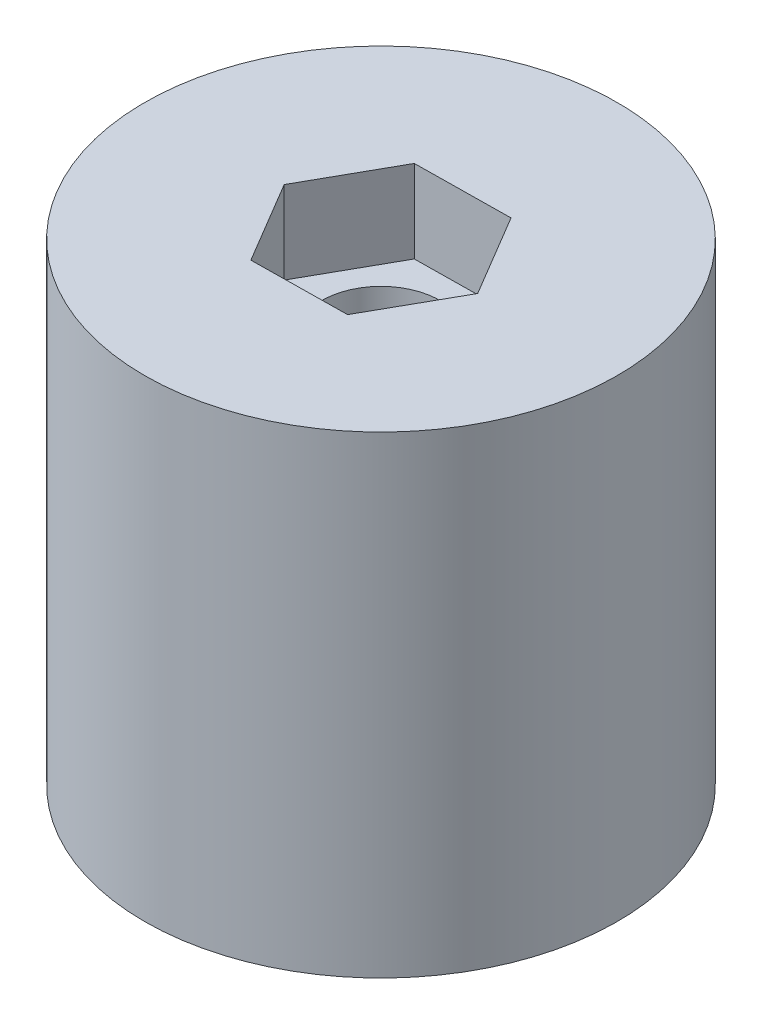
from build123d import *

# Parameters (mm, degrees)
SKETCH1_R           = 10
SKETCH1_R_2         = 2.5
BOSS_EXTRUDE1_DEPTH = 20
CUT_EXTRUDE1_DEPTH  = 3.5


with BuildPart() as part:
    # Sketch1 → Boss-Extrude1 (new body)
    with BuildSketch(Plane(origin=(0, 0, 0), x_dir=(1, 0, 0), z_dir=(0, 1, 0))):
        with Locations(Location((0, 0, 0), (0, 0, 270))):
            Circle(SKETCH1_R)
        with Locations(Location((0, 0, 0), (0, 0, 270))):
            Circle(SKETCH1_R_2, mode=Mode.SUBTRACT)
    extrude(amount=BOSS_EXTRUDE1_DEPTH)

    # Sketch3 → Cut-Extrude1 (cut)
    with BuildSketch(Plane(origin=(0, 20, 0), x_dir=(1, 0, 0), z_dir=(0, 1, 0))):
        Polygon((2.064325377, -3.474463134), (4.041136027, 0.050526651), (1.97681065, 3.524989785), (-2.064325377, 3.474463134), (-4.041136027, -0.050526651), (-1.97681065, -3.524989785), align=None)
    extrude(amount=-CUT_EXTRUDE1_DEPTH, mode=Mode.SUBTRACT)


solid = part.part
